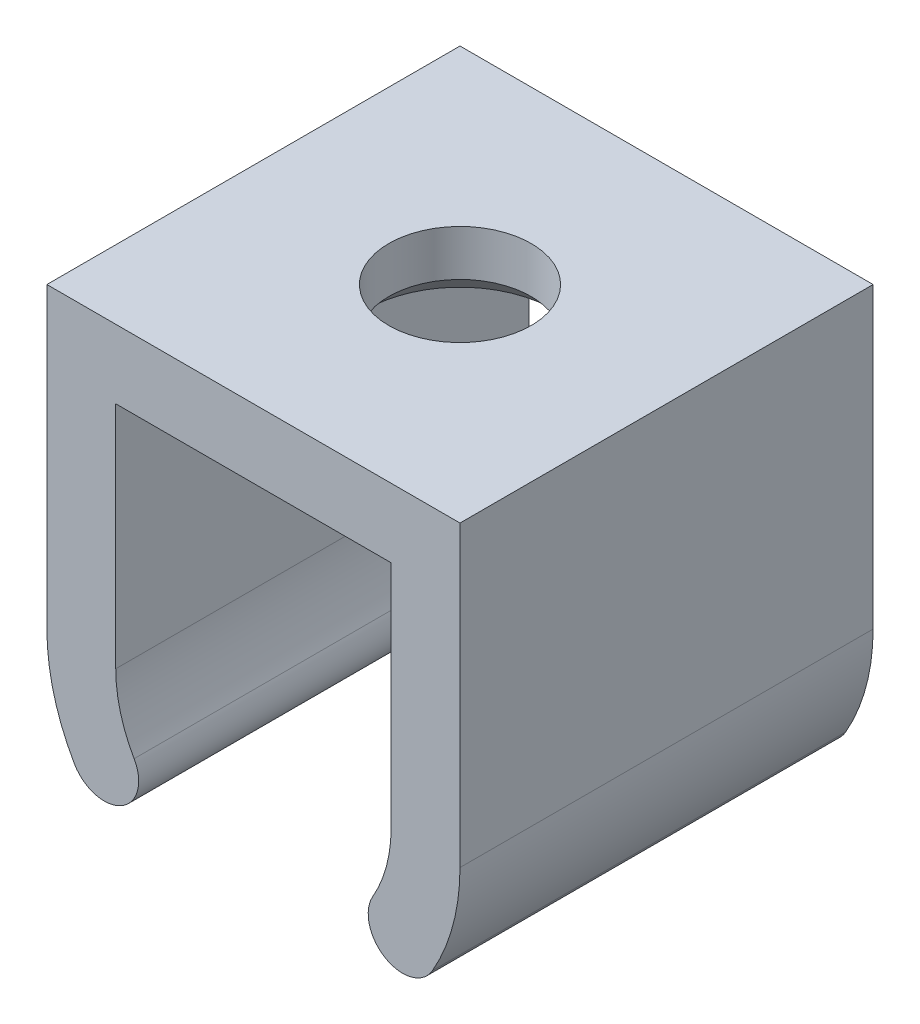
from build123d import *

# Parameters (mm, degrees)
AUFSATZ_LINEAR_AUSTRAGEN1_DEPTH      = 4.5
SCHNITT_LINEAR_AUSTRAGEN1_REACH      = 13.122
SCHNITT_LINEAR_AUSTRAGEN1_END_RADIUS = 3
SKIZZE3_R                            = 1.55
SCHNITT_LINEAR_AUSTRAGEN2_DEPTH      = 12.97914868
SCHNITT_LINEAR_AUSTRAGEN2_DEPTH_BACK = 12.97914868
SKIZZE4_W                            = 6
SKIZZE4_H                            = 5
FASE1_SIZE                           = 0.5


with BuildPart() as part:
    # Skizze1 → Aufsatz-Linear austragen1 (new, symmetric)
    with BuildSketch(Plane.XY):
        with BuildLine():
            Line((-4.5, 6.5), (4.5, 6.5))
            Line((4.5, 6.5), (4.5, 0))
            ThreePointArc((4.5, 0), (4.347413024, -1.161895004), (3.9, -2.244994432))
            ThreePointArc((3.9, -2.244994432), (2.875834261, -2.520828693), (2.6, -1.496662955))
            ThreePointArc((2.6, -1.496662955), (0, 3), (-2.6, -1.496662955))
            ThreePointArc((-2.6, -1.496662955), (-2.875834261, -2.520828693), (-3.9, -2.244994432))
            ThreePointArc((-3.9, -2.244994432), (-4.347413024, -1.161895004), (-4.5, 0))
            Line((-4.5, 0), (-4.5, 6.5))
        make_face()
    extrude(amount=AUFSATZ_LINEAR_AUSTRAGEN1_DEPTH, both=True)

    # Schnitt-Linear austragen1: up to this cylinder (the profile starts outside it)
    schnitt_linear_austragen1_end = Plane(origin=(0, 0, 0), z_dir=(0, 0, -1)) * Cylinder(SCHNITT_LINEAR_AUSTRAGEN1_END_RADIUS, 33.244, mode=Mode.PRIVATE)
    # Skizze3 → Schnitt-Linear austragen1 (cut, up to the surface)
    with BuildSketch(Plane(origin=(0, 6.5, 0), x_dir=(1, 0, 0), z_dir=(0, 1, 0)), mode=Mode.PRIVATE) as schnitt_linear_austragen1_sk1:
        with Locations(Location((0, 0, 0), (0, 0, 270))):
            Circle(SKIZZE3_R)
    schnitt_linear_austragen1_tool1 = extrude(schnitt_linear_austragen1_sk1.sketch, amount=-SCHNITT_LINEAR_AUSTRAGEN1_REACH, mode=Mode.PRIVATE) - schnitt_linear_austragen1_end
    add(schnitt_linear_austragen1_tool1.solids().sort_by_distance((0, 6.5, 0))[0], mode=Mode.SUBTRACT)

    # Skizze4 → Schnitt-Linear austragen2 (cut, two sides: drawn at the far end of the back side and taken through both)
    with BuildSketch(Plane.XY.offset(4.5).offset(-SCHNITT_LINEAR_AUSTRAGEN2_DEPTH_BACK)):
        with Locations((0, 2.5)):
            Rectangle(SKIZZE4_W, SKIZZE4_H)
    extrude(amount=SCHNITT_LINEAR_AUSTRAGEN2_DEPTH + SCHNITT_LINEAR_AUSTRAGEN2_DEPTH_BACK, mode=Mode.SUBTRACT)

    # Fase1
    fase1_edges = [part.edges().sort_by_distance(p)[0] for p in [
        (0, 5, -1.55),
    ]]
    chamfer(fase1_edges, length=FASE1_SIZE)


solid = part.part
